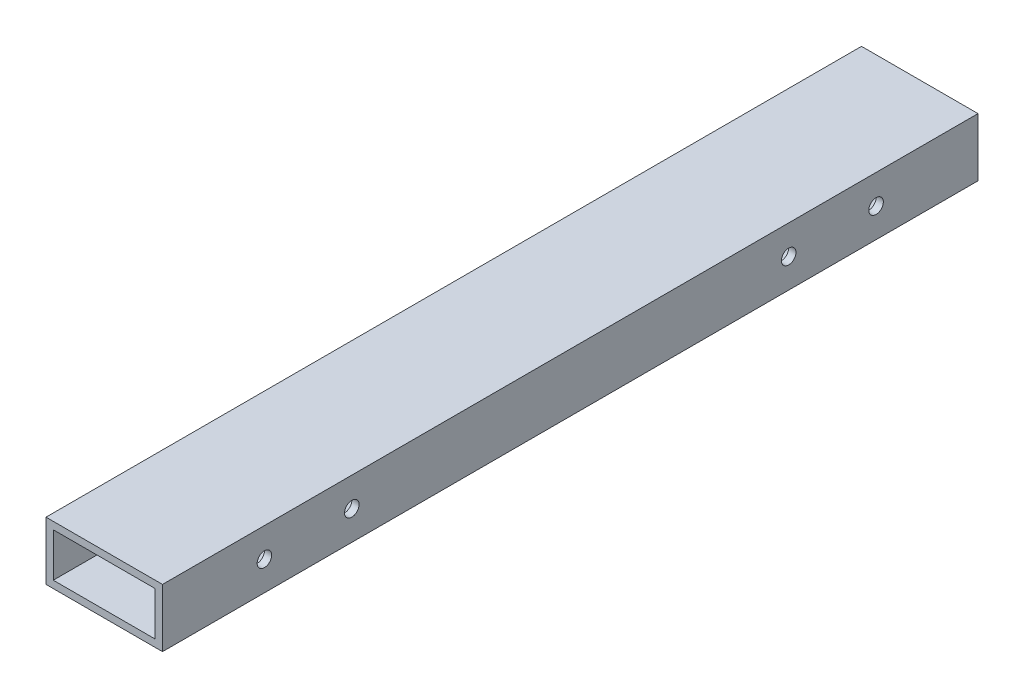
from build123d import *

# Parameters (mm, degrees)
SKETCH1_W               = 50.8
SKETCH1_H               = 25.4
SKETCH1_W_2             = 44.45
SKETCH1_H_2             = 19.05
BOSS_EXTRUDE1_DEPTH     = 355.6
CUT_EXTRUDE1_DEPTH      = 361.10715072
CUT_EXTRUDE1_DEPTH_BACK = 361.10715072
SKETCH2_R               = 3.175


with BuildPart() as part:
    # Sketch1 → Boss-Extrude1 (new body)
    with BuildSketch(Plane.XY):
        with Locations((25.4, 12.7)):
            Rectangle(SKETCH1_W, SKETCH1_H)
        with Locations((25.4, 12.7)):
            Rectangle(SKETCH1_W_2, SKETCH1_H_2, mode=Mode.SUBTRACT)
    extrude(amount=BOSS_EXTRUDE1_DEPTH)

    # Sketch2 → Cut-Extrude1 (cut, two sides: drawn at the far end of the back side and taken through both)
    with BuildSketch(Plane(origin=(50.8, 0, 0), x_dir=(0, 0, -1), z_dir=(1, 0, 0)).offset(-CUT_EXTRUDE1_DEPTH_BACK)):
        with Locations((-273.05, 12.7)):
            Circle(SKETCH2_R)
        with Locations((-311.15, 12.7)):
            Circle(SKETCH2_R)
        with Locations(Location((-44.45, 12.7, 0), (0, 0, 180))):
            Circle(SKETCH2_R)
        with Locations(Location((-82.55, 12.7, 0), (0, 0, 180))):
            Circle(SKETCH2_R)
    extrude(amount=CUT_EXTRUDE1_DEPTH + CUT_EXTRUDE1_DEPTH_BACK, mode=Mode.SUBTRACT)


solid = part.part
